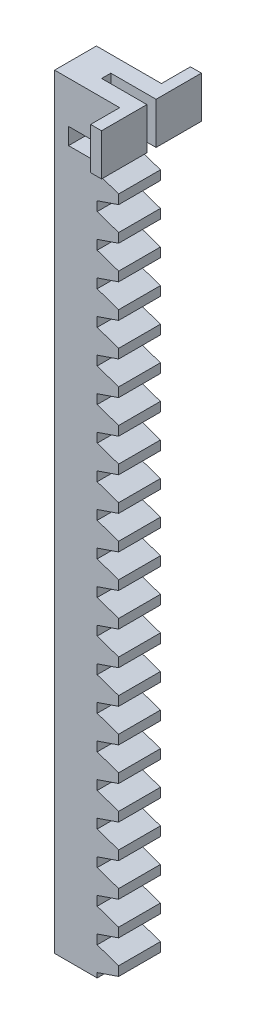
from build123d import *

# Parameters (mm, degrees)
RESSALTO_EXTRUS_O1_DEPTH = 5
BOSS_EXTRUDE1_DEPTH      = 10
CUT_EXTRUDE1_DEPTH       = 50
SKETCH3_W                = 10
SKETCH3_H                = 3.990496563
CUT_EXTRUDE2_DEPTH       = 12


with BuildPart() as part:
    # Esboço1 → Ressalto-extrusão1 (new, symmetric)
    with BuildSketch(Plane.XY):
        Polygon((-2.596479089, -162.874745928), (2.546479089, -161.115750635), (2.546479089, -158.884249365), (-2.596479089, -157.125254072), (-2.596479089, -154.874745928), (2.546479089, -153.115750635), (2.546479089, -150.884249365), (-2.596479089, -149.125254072), (-2.596479089, -146.874745928), (2.546479089, -145.115750635), (2.546479089, -142.884249365), (-2.596479089, -141.125254072), (-2.596479089, -138.874745928), (2.546479089, -137.115750635), (2.546479089, -134.884249365), (-2.596479089, -133.125254072), (-2.596479089, -130.874745928), (2.546479089, -129.115750635), (2.546479089, -126.884249365), (-2.596479089, -125.125254072), (-2.596479089, -122.874745928), (2.546479089, -121.115750635), (2.546479089, -118.884249365), (-2.596479089, -117.125254072), (-2.596479089, -114.874745928), (2.546479089, -113.115750635), (2.546479089, -110.884249365), (-2.596479089, -109.125254072), (-2.596479089, -106.874745928), (2.546479089, -105.115750635), (2.546479089, -102.884249365), (-2.596479089, -101.125254072), (-2.596479089, -98.874745928), (2.546479089, -97.115750635), (2.546479089, -94.884249365), (-2.596479089, -93.125254072), (-2.596479089, -90.874745928), (2.546479089, -89.115750635), (2.546479089, -86.884249365), (-2.596479089, -85.125254072), (-2.596479089, -82.874745928), (2.546479089, -81.115750635), (2.546479089, -78.884249365), (-2.596479089, -77.125254072), (-2.596479089, -74.874745928), (2.546479089, -73.115750635), (2.546479089, -70.884249365), (-2.596479089, -69.125254072), (-2.596479089, -66.874745928), (2.546479089, -65.115750635), (2.546479089, -62.884249365), (-2.596479089, -61.125254072), (-2.596479089, -58.874745928), (2.546479089, -57.115750635), (2.546479089, -54.884249365), (-2.596479089, -53.125254072), (-2.596479089, -50.874745928), (2.546479089, -49.115750635), (2.546479089, -46.884249365), (-2.596479089, -45.125254072), (-2.596479089, -42.874745928), (2.546479089, -41.115750635), (2.546479089, -38.884249365), (-2.596479089, -37.125254072), (-2.596479089, -34.874745928), (2.546479089, -33.115750635), (2.546479089, -30.884249365), (-2.596479089, -29.125254072), (-2.596479089, -26.874745928), (2.546479089, -25.115750635), (2.546479089, -22.884249365), (-2.596479089, -21.125254072), (-2.596479089, -18.874745928), (2.546479089, -17.115750635), (2.546479089, -14.884249365), (-2.596479089, -13.125254072), (-2.596479089, -10.874745928), (2.546479089, -9.115750635), (2.546479089, -6.884249365), (-2.596479089, -5.125254072), (-2.596479089, -2.874745928), (2.546479089, -1.115750635), (2.546479089, 1.115750635), (-2.596479089, 2.874745928), (-2.596479089, 5.125254072), (2.546479089, 6.884249365), (2.546479089, 9.115750635), (-12.782395447, 9.115750635), (-12.782395447, -164), (-2.596479089, -164), align=None)
    extrude(amount=RESSALTO_EXTRUS_O1_DEPTH, both=True)

    # Sketch1 → Boss-Extrude1 (add)
    with BuildSketch(Plane(origin=(0, 9.115750635, 0), x_dir=(1, 0, 0), z_dir=(0, 1, 0))):
        Polygon((2.782395447, 5), (-12.782395447, 5), (-12.782395447, -5), (2.782395447, -5), (2.782395447, -11.950821596), (7.782395447, -11.950821596), (12.782395447, -11.950821596), (12.782395447, -1.100821596), (7.782395447, -1.100821596), (-5.426721346, -1.100821596), (-5.426721346, 1.100821596), (2.782395447, 1.100821596), (12.782395447, 1.100821596), (12.782395447, 11.946726984), (7.782395447, 11.946726984), (2.782395447, 11.946726984), align=None)
    extrude(amount=BOSS_EXTRUDE1_DEPTH)

    # Sketch2 → Cut-Extrude1 (cut)
    with BuildSketch(Plane(origin=(0, 19.115750635, 0), x_dir=(1, 0, 0), z_dir=(0, 1, 0))):
        Polygon((10.616582745, 13.051407562), (13.445399336, 13.051407562), (13.445399336, -14.793690682), (10.616582745, -14.793690682), (5.402017224, -14.793690682), (5.402017224, 13.051407562), align=None)
    extrude(amount=-CUT_EXTRUDE1_DEPTH, mode=Mode.SUBTRACT)

    # Sketch3 → Cut-Extrude2 (cut)
    with BuildSketch(Plane(origin=(2.546479089, 0, 0), x_dir=(0, 0, -1), z_dir=(1, 0, 0))):
        with Locations((0, 7.120502354)):
            Rectangle(SKETCH3_W, SKETCH3_H)
    extrude(amount=-CUT_EXTRUDE2_DEPTH, mode=Mode.SUBTRACT)


solid = part.part
